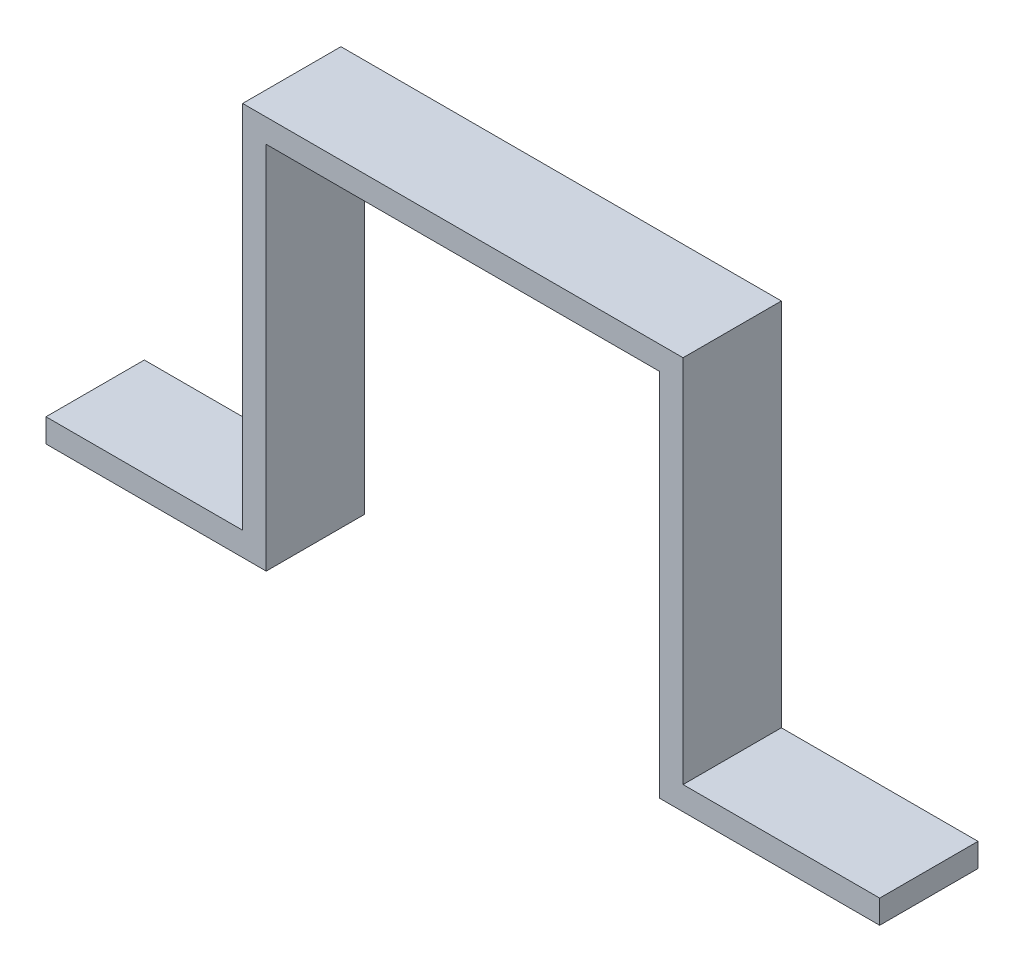
from build123d import *

# Parameters (mm, degrees)
BOSS_EXTRUDE1_DEPTH = 12.5


with BuildPart() as part:
    # Sketch1 → Boss-Extrude1 (new, symmetric)
    with BuildSketch(Plane.XY):
        Polygon((-106, 0), (-106, 6), (-56, 6), (-56, 100), (56, 100), (56, 6), (106, 6), (106, 0), (50, 0), (50, 94), (-50, 94), (-50, 0), align=None)
    extrude(amount=BOSS_EXTRUDE1_DEPTH, both=True)


solid = part.part
